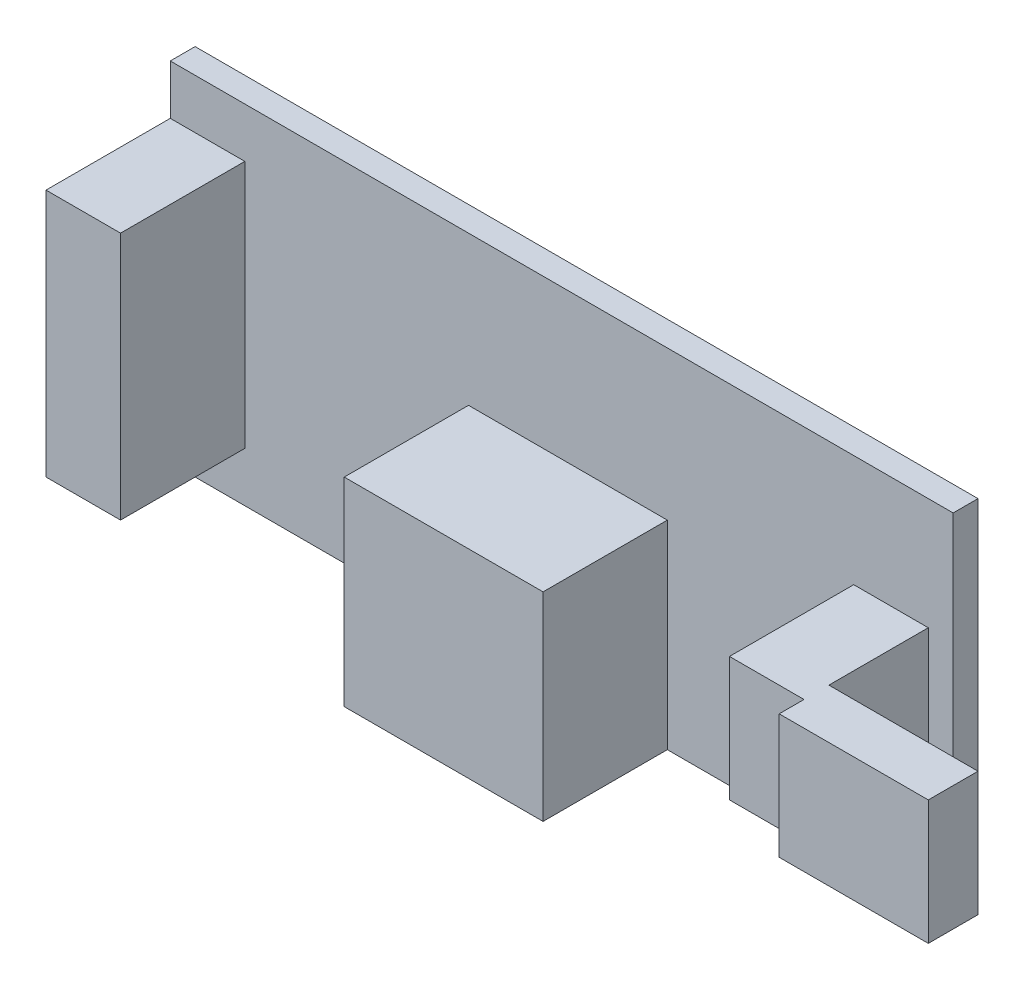
from build123d import *

# Parameters (mm, degrees)
ESQUISSE1_W        = 31.5
ESQUISSE1_H        = 14
BOSS_EXTRU_1_DEPTH = 1
ESQUISSE2_W        = 8
ESQUISSE2_H        = 8
BOSS_EXTRU_2_DEPTH = 5
ESQUISSE3_W        = 3
ESQUISSE3_H        = 5
BOSS_EXTRU_3_DEPTH = 5
ESQUISSE4_W        = 3
ESQUISSE4_H        = 10
BOSS_EXTRU_4_DEPTH = 5
ESQUISSE6_W        = 2
ESQUISSE6_H        = 5
BOSS_EXTRU_6_DEPTH = 6


with BuildPart() as part:
    # Esquisse1 → Boss.-Extru.1 (new body)
    with BuildSketch(Plane.XY):
        with Locations((-3.425842613, 1.088280058)):
            Rectangle(ESQUISSE1_W, ESQUISSE1_H)
    extrude(amount=-BOSS_EXTRU_1_DEPTH)

    # Esquisse2 → Boss.-Extru.2 (add)
    with BuildSketch(Plane.XY):
        with Locations((-3.175842613, -1.911719942)):
            Rectangle(ESQUISSE2_W, ESQUISSE2_H)
    extrude(amount=BOSS_EXTRU_2_DEPTH)

    # Esquisse3 → Boss.-Extru.3 (add)
    with BuildSketch(Plane.XY):
        with Locations((9.824157387, 1.088280058)):
            Rectangle(ESQUISSE3_W, ESQUISSE3_H)
    extrude(amount=BOSS_EXTRU_3_DEPTH)

    # Esquisse4 → Boss.-Extru.4 (add)
    with BuildSketch(Plane.XY):
        with Locations((-17.675842613, 1.088280058)):
            Rectangle(ESQUISSE4_W, ESQUISSE4_H)
    extrude(amount=BOSS_EXTRU_4_DEPTH)

    # Esquisse6 → Boss.-Extru.6 (add)
    with BuildSketch(Plane(origin=(11.324157387, 0, 0), x_dir=(0, 0, -1), z_dir=(1, 0, 0))):
        with Locations((-5, 1.088280058)):
            Rectangle(ESQUISSE6_W, ESQUISSE6_H)
    extrude(amount=BOSS_EXTRU_6_DEPTH)


solid = part.part
